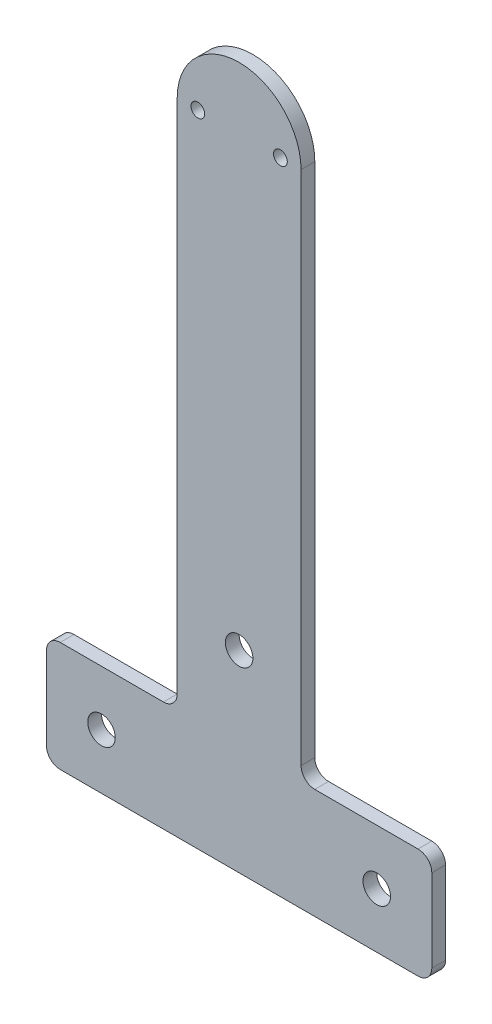
from build123d import *

# Parameters (mm, degrees)
SKETCH_1_R      = 2
SKETCH_1_R_2    = 1
EXTRUDE_1_DEPTH = 2
FILLET_1_R      = 2


with BuildPart() as part:
    # 草图1 → 凸台-拉伸1 (new body)
    with BuildSketch(Plane.XY):
        with BuildLine():
            Line((-22.340449028, 112.565520938), (-22.340449028, 35.565520938))
            Line((-22.340449028, 35.565520938), (-41.340449028, 35.565520938))
            Line((-41.340449028, 35.565520938), (-41.340449028, 19.565520938))
            Line((-41.340449028, 19.565520938), (14.659550972, 19.565520938))
            Line((14.659550972, 19.565520938), (14.659550972, 35.565520938))
            Line((14.659550972, 35.565520938), (-4.340449028, 35.565520938))
            Line((-4.340449028, 35.565520938), (-4.340449028, 112.565520938))
            ThreePointArc((-4.340449028, 112.565520938), (-13.340449028, 121.565520938), (-22.340449028, 112.565520938))
        make_face()
        with Locations((-33.340449028, 27.565520938)):
            Circle(SKETCH_1_R, mode=Mode.SUBTRACT)
        with Locations(Location((6.659550972, 27.565520938, 0), (0, 0, 180))):
            Circle(SKETCH_1_R, mode=Mode.SUBTRACT)
        with Locations((-7.340449028, 112.565520938)):
            Circle(SKETCH_1_R_2, mode=Mode.SUBTRACT)
        with Locations(Location((-19.340449028, 112.565520938, 0), (0, 0, 180))):
            Circle(SKETCH_1_R_2, mode=Mode.SUBTRACT)
        with Locations((-13.340449028, 47.565520938)):
            Circle(SKETCH_1_R, mode=Mode.SUBTRACT)
    extrude(amount=EXTRUDE_1_DEPTH)

    # 圆角1
    fillet_1_edges = [part.edges().sort_by_distance(p)[0] for p in [
        (-41.340449028, 19.565520938, 1),
        (-41.340449028, 35.565520938, 1),
        (-22.340449028, 35.565520938, 1),
        (-4.340449028, 35.565520938, 1),
        (14.659550972, 35.565520938, 1),
        (14.659550972, 19.565520938, 1),
    ]]
    fillet(fillet_1_edges, radius=FILLET_1_R)


solid = part.part
